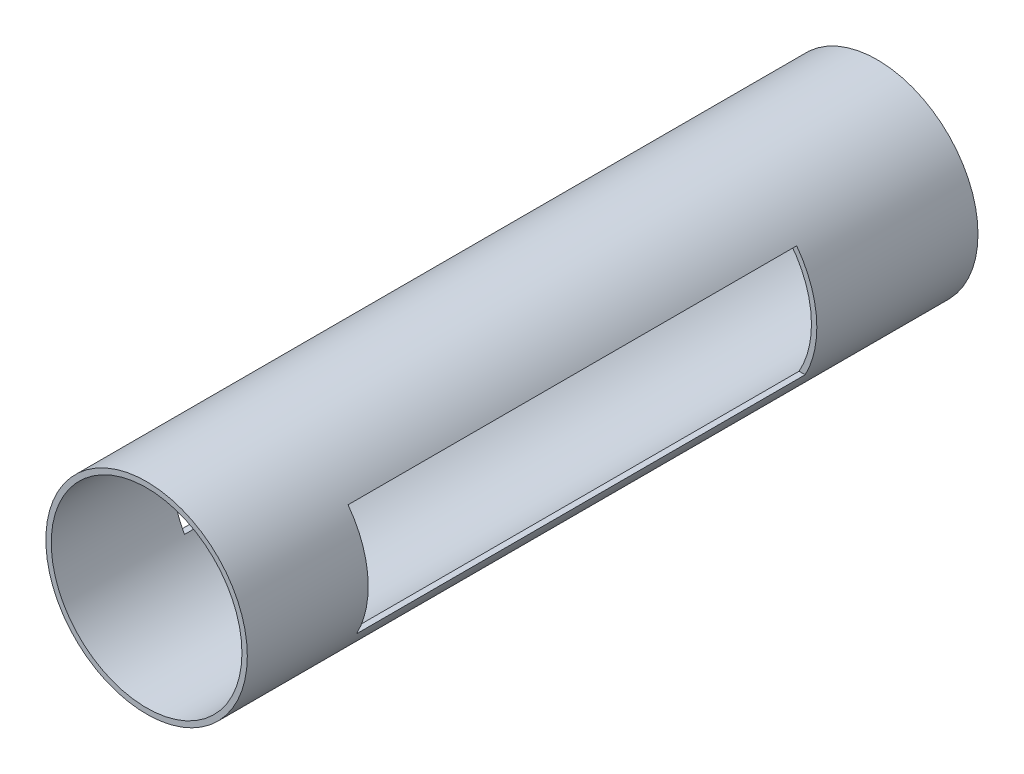
from build123d import *

# Parameters (mm, degrees)
SKETCH1_R               = 37.5
SKETCH1_R_2             = 35.5
BOSS_EXTRUDE1_DEPTH     = 272
CUT_EXTRUDE1_DEPTH      = 278.121814371
CUT_EXTRUDE1_DEPTH_BACK = 278.121814371
SKETCH2_W               = 167
SKETCH2_H               = 40


with BuildPart() as part:
    # Sketch1 → Boss-Extrude1 (new body)
    with BuildSketch(Plane.XY):
        Circle(SKETCH1_R)
        Circle(SKETCH1_R_2, mode=Mode.SUBTRACT)
    extrude(amount=BOSS_EXTRUDE1_DEPTH)

    # Sketch2 → Cut-Extrude1 (cut, two sides: drawn at the far end of the back side and taken through both)
    with BuildSketch(Plane(origin=(0, 0, 0), x_dir=(0, 0, -1), z_dir=(1, 0, 0)).offset(-CUT_EXTRUDE1_DEPTH_BACK)):
        with Locations((-143.5, 2.5)):
            Rectangle(SKETCH2_W, SKETCH2_H)
    extrude(amount=CUT_EXTRUDE1_DEPTH + CUT_EXTRUDE1_DEPTH_BACK, mode=Mode.SUBTRACT)


solid = part.part
